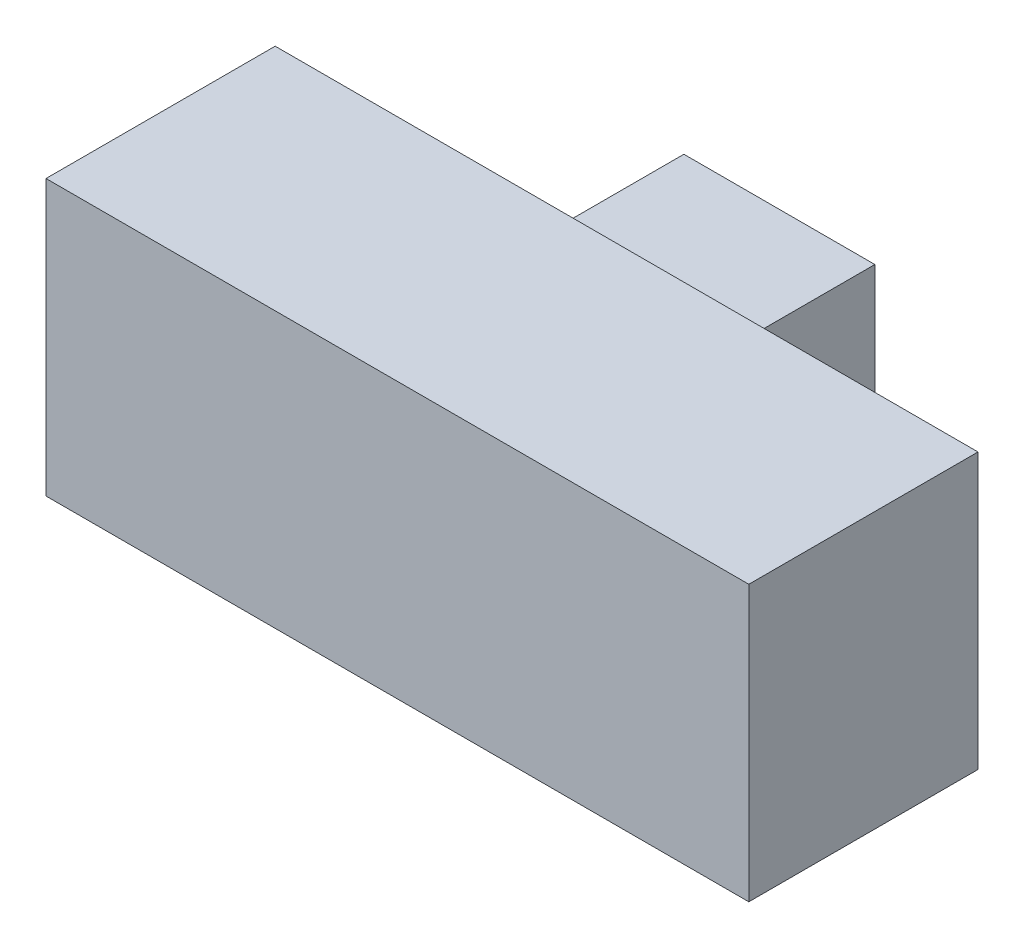
from build123d import *

# Parameters (mm, degrees)
SKETCH1_W           = 9.2
SKETCH1_H           = 3.6
BOSS_EXTRUDE1_DEPTH = 3
SKETCH2_W           = 2.5
SKETCH2_H           = 2.5
BOSS_EXTRUDE2_DEPTH = 2


with BuildPart() as part:
    # Sketch1 → Boss-Extrude1 (new body)
    with BuildSketch(Plane.XY):
        Rectangle(SKETCH1_W, SKETCH1_H)
    extrude(amount=BOSS_EXTRUDE1_DEPTH)

    # Sketch2 → Boss-Extrude2 (add)
    with BuildSketch(Plane(origin=(0, 0, 0), x_dir=(-1, 0, 0), z_dir=(0, 0, -1))):
        Rectangle(SKETCH2_W, SKETCH2_H)
    extrude(amount=BOSS_EXTRUDE2_DEPTH)


solid = part.part
